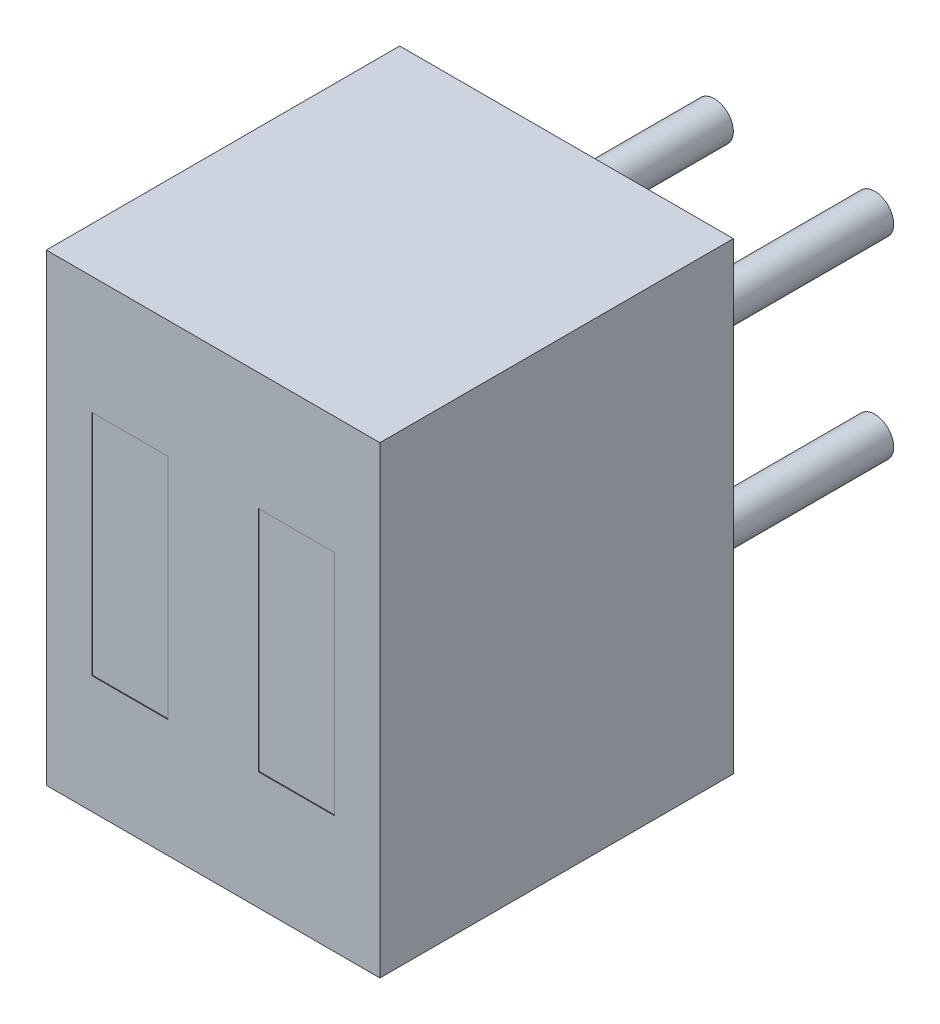
from build123d import *

# Parameters (mm, degrees)
SKETCH_1_W          = 4.39
SKETCH_1_H          = 6.1
EXTRUDE_1_DEPTH     = 4.65
SKETCH_2_W          = 1
SKETCH_2_H          = 3
CUT_EXTRUDE_1_DEPTH = 0.01
SKETCH_3_R          = 0.25
EXTRUDE_2_DEPTH     = 3


with BuildPart() as part:
    # Эскиз1 → Бобышка-Вытянуть1 (new body)
    with BuildSketch(Plane.XY):
        with Locations((2.195, 3.05)):
            Rectangle(SKETCH_1_W, SKETCH_1_H)
    extrude(amount=EXTRUDE_1_DEPTH)

    # Эскиз2 → Вырез-Вытянуть1 (cut)
    with BuildSketch(Plane.XY.offset(4.65)):
        with Locations((1.1, 3.05)):
            Rectangle(SKETCH_2_W, SKETCH_2_H)
        with Locations((3.29, 3.05)):
            Rectangle(SKETCH_2_W, SKETCH_2_H)
    extrude(amount=-CUT_EXTRUDE_1_DEPTH, mode=Mode.SUBTRACT)

    # Эскиз3 → Бобышка-Вытянуть2 (add)
    with BuildSketch(Plane.XY):
        with Locations((1.14, 1.78)):
            Circle(SKETCH_3_R)
        with Locations((3.25, 1.78)):
            Circle(SKETCH_3_R)
        with Locations((3.25, 4.32)):
            Circle(SKETCH_3_R)
        with Locations((1.14, 4.32)):
            Circle(SKETCH_3_R)
    extrude(amount=-EXTRUDE_2_DEPTH)


solid = part.part
